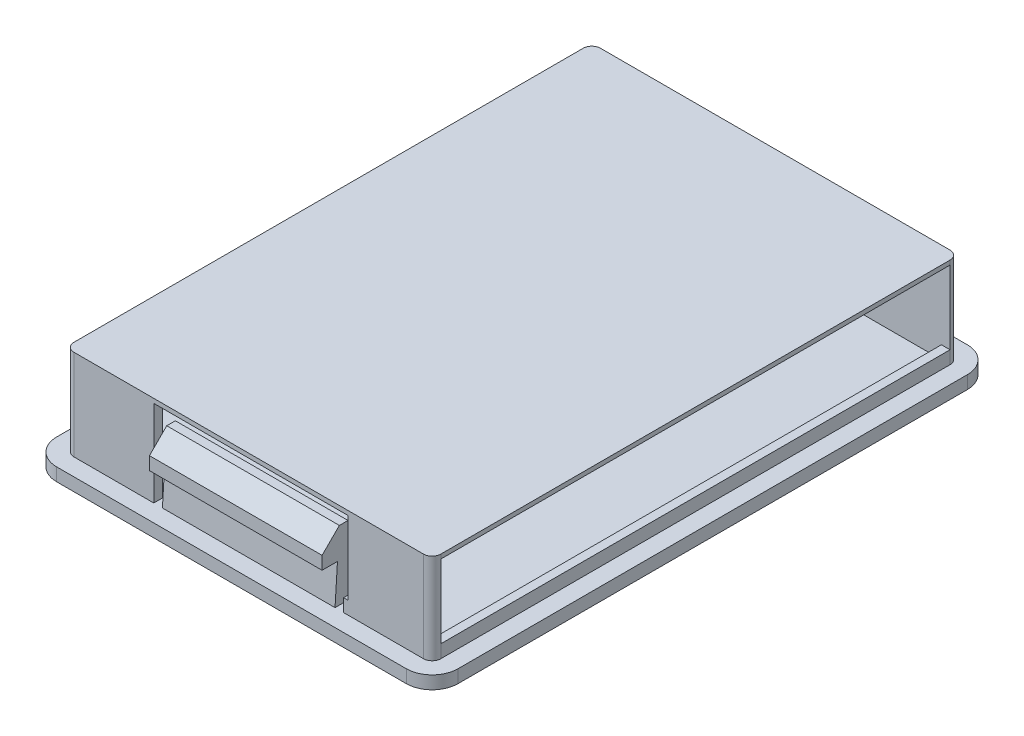
from build123d import *

# Parameters (mm, degrees)
SKETCH1_W            = 46.5
SKETCH1_H            = 65
BOSS_EXTRUDE1_DEPTH  = 1.5
FILLET1_R            = 3
SKETCH2_W            = 20
SKETCH2_H            = 1.5
BOSS_EXTRUDE2_DEPTH  = 8
CUT_EXTRUDE1_DEPTH   = 24
BOSS_EXTRUDE5_DEPTH  = 20
FILLET4_R            = 0.5
FILLET4_OF_MIRROR1_R = 0.5
BOSS_EXTRUDE6_DEPTH  = 1.5
BOSS_EXTRUDE7_DEPTH  = 0.5
BOSS_EXTRUDE8_START  = -9
BOSS_EXTRUDE8_DEPTH  = 9


with BuildPart() as part:
    # Sketch1 → Boss-Extrude1 (new body)
    with BuildSketch(Plane(origin=(0, 0, 0), x_dir=(1, 0, 0), z_dir=(0, 1, 0))):
        Rectangle(SKETCH1_W, SKETCH1_H)
    extrude(amount=BOSS_EXTRUDE1_DEPTH)

    # Fillet1
    fillet1_edges = [part.edges().sort_by_distance(p)[0] for p in [
        (23.25, 0.75, 32.5),
        (-23.25, 0.75, 32.5),
        (-23.25, 0.75, -32.5),
        (23.25, 0.75, -32.5),
    ]]
    fillet(fillet1_edges, radius=FILLET1_R)

    # Sketch2 → Boss-Extrude2 (add)
    with BuildSketch(Plane(origin=(0, 1.5, 0), x_dir=(1, 0, 0), z_dir=(0, 1, 0))):
        with Locations((0, 29.75)):
            Rectangle(SKETCH2_W, SKETCH2_H)
    boss_extrude2 = extrude(amount=BOSS_EXTRUDE2_DEPTH)

    # Sketch5 → Cut-Extrude1 (cut)
    with BuildSketch(Plane.ZY.offset(10)):
        Polygon((-30.5, 9.5), (-30.5, 1.5), (-30, 9.5), align=None)
    cut_extrude1 = extrude(amount=-CUT_EXTRUDE1_DEPTH, mode=Mode.SUBTRACT)

    # Sketch6 → Boss-Extrude5 (add)
    with BuildSketch(Plane.ZY.offset(10)):
        Polygon((-29, 9.5), (-30, 9.5), (-32, 7.5), (-32, 6), (-29, 6), align=None)
    boss_extrude5 = extrude(amount=-BOSS_EXTRUDE5_DEPTH)

    # Fillet4
    fillet4_edges = [part.edges().sort_by_distance(p)[0] for p in [
        (0, 1.5, -29),
    ]]
    fillet(fillet4_edges, radius=FILLET4_R)

    # Mirror1: Boss-Extrude2, Cut-Extrude1, Boss-Extrude5 across plane
    add(boss_extrude2.mirror(Plane.XY))
    add(cut_extrude1.mirror(Plane.XY), mode=Mode.SUBTRACT)
    add(boss_extrude5.mirror(Plane.XY))

    # Fillet4 of Mirror1
    fillet4_of_mirror1_edges = [part.edges().sort_by_distance(p)[0] for p in [
        (0, 1.5, 29),
    ]]
    fillet(fillet4_of_mirror1_edges, radius=FILLET4_OF_MIRROR1_R)

    # Sketch7 → Boss-Extrude6 (add)
    with BuildSketch(Plane(origin=(0, 1.5, 0), x_dir=(1, 0, 0), z_dir=(0, 1, 0))):
        with BuildLine():
            Line((-11, 30.5), (-20.25, 30.5))
            ThreePointArc((-20.25, 30.5), (-20.957106781, 30.207106781), (-21.25, 29.5))
            Line((-21.25, 29.5), (-21.25, -29.5))
            ThreePointArc((-21.25, -29.5), (-20.957106781, -30.207106781), (-20.25, -30.5))
            Line((-20.25, -30.5), (-11, -30.5))
            Line((-11, -30.5), (-11, -29.5))
            Line((-11, -29.5), (-20.25, -29.5))
            Line((-20.25, -29.5), (-20.25, 29.5))
            Line((-20.25, 29.5), (-11, 29.5))
            Line((-11, 29.5), (-11, 30.5))
        make_face()
        with BuildLine():
            Line((20.25, -29.5), (20.25, 29.5))
            Line((20.25, 29.5), (11, 29.5))
            Line((11, 29.5), (11, 30.5))
            Line((11, 30.5), (20.25, 30.5))
            ThreePointArc((20.25, 30.5), (20.957106781, 30.207106781), (21.25, 29.5))
            Line((21.25, 29.5), (21.25, -29.5))
            ThreePointArc((21.25, -29.5), (20.957106781, -30.207106781), (20.25, -30.5))
            Line((20.25, -30.5), (11, -30.5))
            Line((11, -30.5), (11, -29.5))
            Line((11, -29.5), (20.25, -29.5))
        make_face()
    extrude(amount=BOSS_EXTRUDE6_DEPTH)



with BuildPart() as body_2:
    # Sketch8 → Boss-Extrude7 (new body)
    with BuildSketch(Plane(origin=(0, 11.5, 0), x_dir=(1, 0, 0), z_dir=(0, 1, 0))):
        with BuildLine():
            Line((-11, -30.5), (11, -30.5))
            Line((11, -30.5), (20.25, -30.5))
            ThreePointArc((20.25, -30.5), (20.957106781, -30.207106781), (21.25, -29.5))
            Line((21.25, -29.5), (21.25, 29.5))
            ThreePointArc((21.25, 29.5), (20.957106781, 30.207106781), (20.25, 30.5))
            Line((20.25, 30.5), (11, 30.5))
            Line((11, 30.5), (-11, 30.5))
            Line((-11, 30.5), (-20.25, 30.5))
            ThreePointArc((-20.25, 30.5), (-20.957106781, 30.207106781), (-21.25, 29.5))
            Line((-21.25, 29.5), (-21.25, -29.5))
            ThreePointArc((-21.25, -29.5), (-20.957106781, -30.207106781), (-20.25, -30.5))
            Line((-20.25, -30.5), (-11, -30.5))
        make_face()
    extrude(amount=BOSS_EXTRUDE7_DEPTH)


with BuildPart() as part_1:
    add(part.part)

    add(body_2.part)  # Boss-Extrude8 merges body 2
    # Sketch9 → Boss-Extrude8 (add)
    with BuildSketch(Plane(origin=(0, 12, 0), x_dir=(1, 0, 0), z_dir=(0, 1, 0)).offset(BOSS_EXTRUDE8_START)):
        with BuildLine():
            Line((11, 29.5), (21.25, 29.5))
            ThreePointArc((21.25, 29.5), (20.957106781, 30.207106781), (20.25, 30.5))
            Line((20.25, 30.5), (11, 30.5))
            Line((11, 30.5), (11, 29.5))
        make_face()
        with BuildLine():
            ThreePointArc((20.25, -30.5), (20.957106781, -30.207106781), (21.25, -29.5))
            Line((21.25, -29.5), (11.5, -29.5))
            Line((11.5, -29.5), (11.5, -30.5))
            Line((11.5, -30.5), (20.25, -30.5))
        make_face()
        with BuildLine():
            Line((-11, 29.5), (-11, 30.5))
            Line((-11, 30.5), (-20.25, 30.5))
            ThreePointArc((-20.25, 30.5), (-20.957106781, 30.207106781), (-21.25, 29.5))
            Line((-21.25, 29.5), (-21.25, -29.5))
            ThreePointArc((-21.25, -29.5), (-20.957106781, -30.207106781), (-20.25, -30.5))
            Line((-20.25, -30.5), (-11, -30.5))
            Line((-11, -30.5), (-11, -29.5))
            Line((-11, -29.5), (-20.25, -29.5))
            Line((-20.25, -29.5), (-20.25, 29.5))
            Line((-20.25, 29.5), (-11, 29.5))
        make_face()
    extrude(amount=BOSS_EXTRUDE8_DEPTH)


solid = part_1.part
